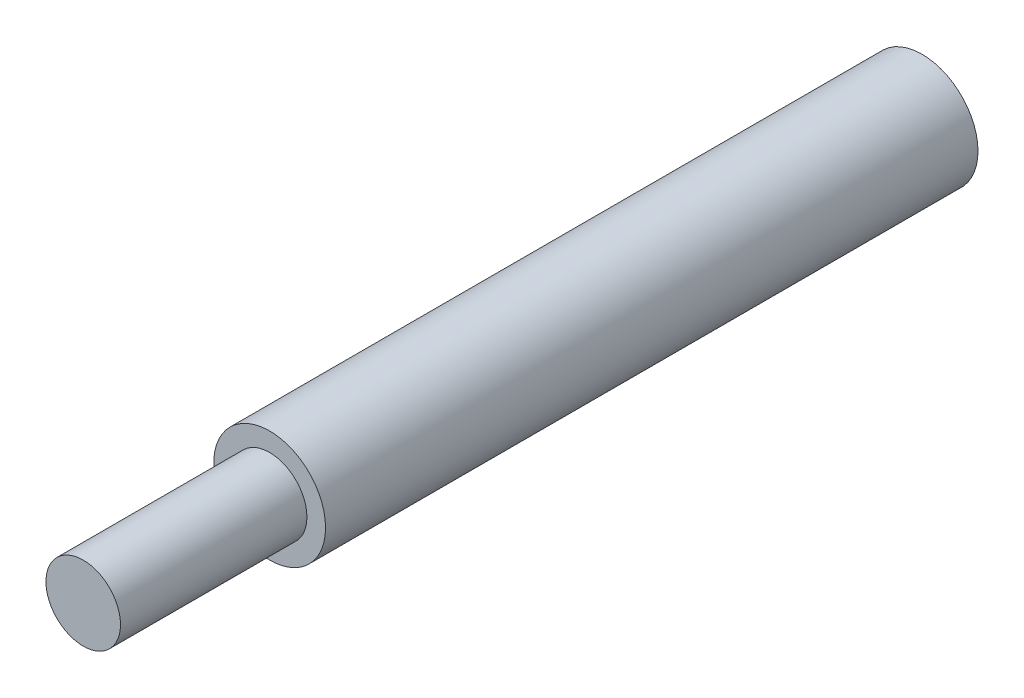
from build123d import *

# Parameters (mm, degrees)
SKETCH1_R           = 6
BOSS_EXTRUDE1_DEPTH = 70
SKETCH2_R           = 4
BOSS_EXTRUDE2_DEPTH = 20


with BuildPart() as part:
    # Sketch1 → Boss-Extrude1 (new body)
    with BuildSketch(Plane.XY):
        Circle(SKETCH1_R)
    extrude(amount=BOSS_EXTRUDE1_DEPTH)

    # Sketch2 → Boss-Extrude2 (add)
    with BuildSketch(Plane.XY.offset(70)):
        Circle(SKETCH2_R)
    extrude(amount=BOSS_EXTRUDE2_DEPTH)


solid = part.part
